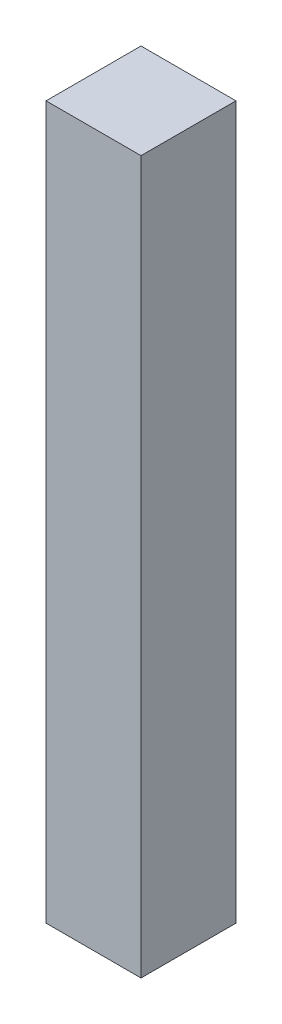
from build123d import *

# Parameters (mm, degrees)
SKETCH1_W           = 20
SKETCH1_H           = 20
BOSS_EXTRUDE1_DEPTH = 150


with BuildPart() as part:
    # Sketch1 → Boss-Extrude1 (new body)
    with BuildSketch(Plane(origin=(0, 0, 0), x_dir=(1, 0, 0), z_dir=(0, 1, 0))):
        with Locations((10, -10)):
            Rectangle(SKETCH1_W, SKETCH1_H)
    extrude(amount=BOSS_EXTRUDE1_DEPTH)


solid = part.part
